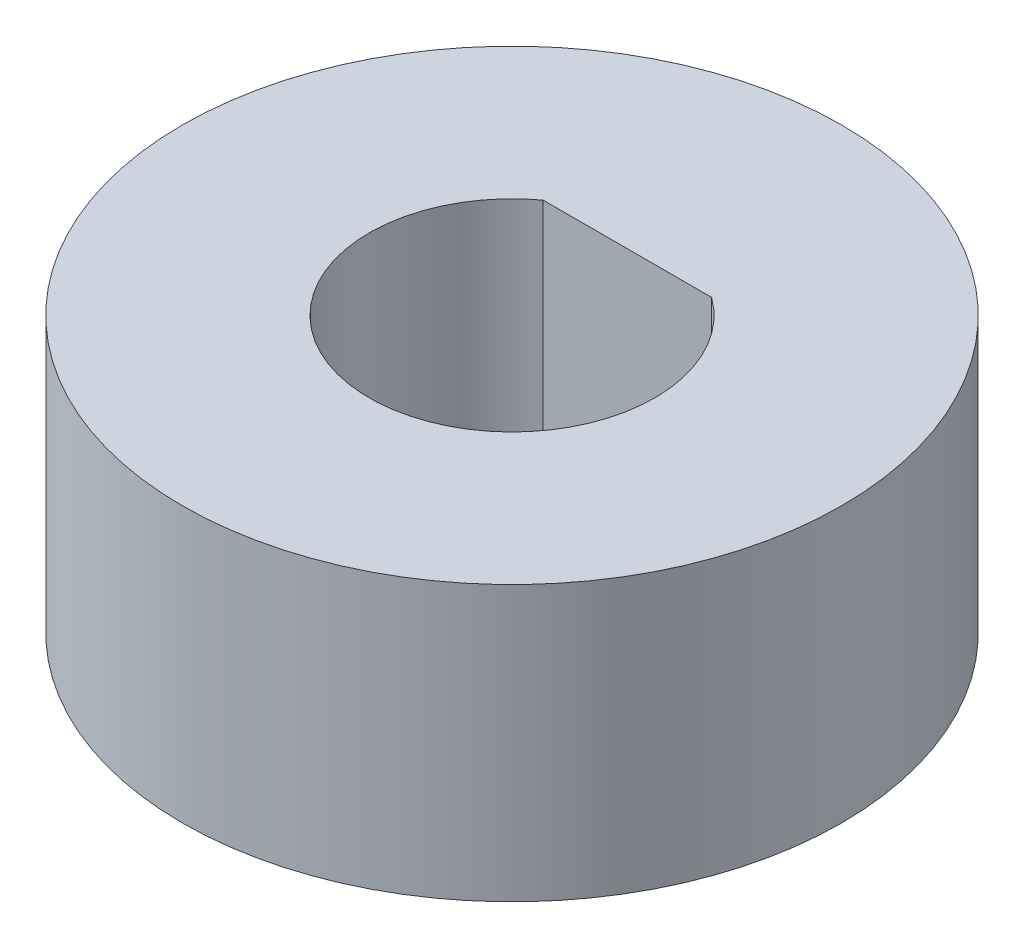
from build123d import *

# Parameters (mm, degrees)
SKETCH1_R           = 6
BOSS_EXTRUDE1_DEPTH = 5
BOSS_EXTRUDE2_START = -5
BOSS_EXTRUDE2_DEPTH = 5
CUT_EXTRUDE1_DEPTH  = 5


with BuildPart() as part:
    # Sketch1 → Boss-Extrude1 (new body)
    with BuildSketch(Plane(origin=(0, 0, 0), x_dir=(1, 0, 0), z_dir=(0, 1, 0))):
        with Locations(Location((0, 0, 0), (0, 0, 270))):
            Circle(SKETCH1_R)
        with BuildLine():
            ThreePointArc((-1.549193338, 2.15), (0, -2.65), (1.549193338, 2.15))
            Line((1.549193338, 2.15), (-1.549193338, 2.15))
        make_face(mode=Mode.SUBTRACT)
    extrude(amount=BOSS_EXTRUDE1_DEPTH)

    # Sketch2 → Boss-Extrude2 (add)
    with BuildSketch(Plane(origin=(0, 5, 0), x_dir=(1, 0, 0), z_dir=(0, 1, 0)).offset(BOSS_EXTRUDE2_START)):
        with BuildLine():
            Line((1.549193338, 2.15), (-1.549193338, 2.15))
            ThreePointArc((-1.549193338, 2.15), (0, -2.65), (1.549193338, 2.15))
        make_face()
        with BuildLine():
            Line((1.526433752, 2.08), (-1.526433752, 2.08))
            ThreePointArc((-1.526433752, 2.08), (0, -2.58), (1.526433752, 2.08))
        make_face(mode=Mode.SUBTRACT)
    extrude(amount=BOSS_EXTRUDE2_DEPTH)

    # Sketch3 → Cut-Extrude1 (cut)
    with BuildSketch(Plane(origin=(0, 5, 0), x_dir=(1, 0, 0), z_dir=(0, 1, 0))):
        with BuildLine():
            Line((1.532970972, 2.1), (-1.532970972, 2.1))
            ThreePointArc((-1.532970972, 2.1), (0, -2.6), (1.532970972, 2.1))
        make_face()
    extrude(amount=-CUT_EXTRUDE1_DEPTH, mode=Mode.SUBTRACT)


solid = part.part
